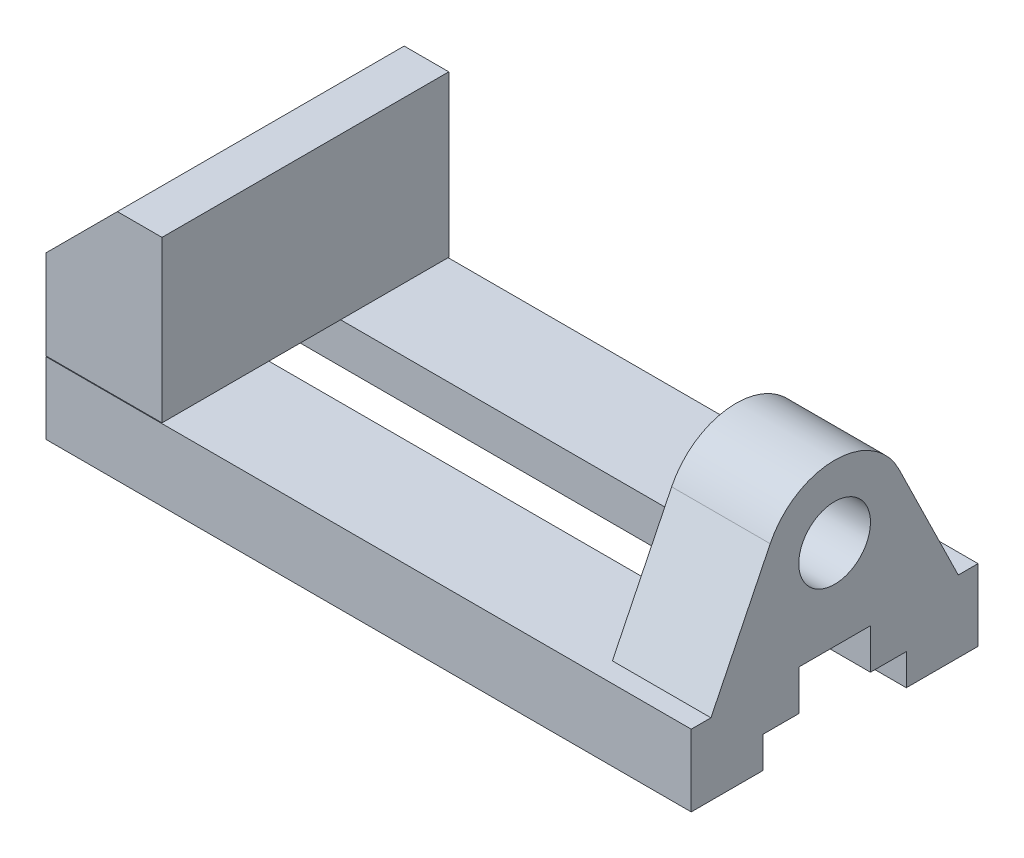
from build123d import *

# Parameters (mm, degrees)
SKETCH1_W           = 144
SKETCH1_H           = 16
BOSS_EXTRUDE1_DEPTH = 32
BOSS_EXTRUDE2_DEPTH = 64
SKETCH3_R           = 8
BOSS_EXTRUDE3_DEPTH = 22
CUT_EXTRUDE1_DEPTH  = 154.935051239


with BuildPart() as part:
    # Sketch1 → Boss-Extrude1 (new, symmetric)
    with BuildSketch(Plane.XY):
        Rectangle(SKETCH1_W, SKETCH1_H)
    extrude(amount=BOSS_EXTRUDE1_DEPTH, both=True)

    # Sketch3 → Boss-Extrude3 (add)
    with BuildSketch(Plane(origin=(72, 0, 0), x_dir=(0, 0, -1), z_dir=(1, 0, 0))):
        with BuildLine():
            Line((-27.596884244, 8), (-32, 8))
            Line((-32, 8), (-32, -8))
            Line((-32, -8), (32, -8))
            Line((32, -8), (32, 8))
            Line((32, 8), (27.596884244, 8))
            Line((27.596884244, 8), (14.372185951, 35.031377602))
            ThreePointArc((14.372185951, 35.031377602), (0, 44), (-14.372185951, 35.031377602))
            Line((-14.372185951, 35.031377602), (-27.596884244, 8))
        make_face()
        with Locations(Location((0, 28, 0), (0, 0, 90))):
            Circle(SKETCH3_R, mode=Mode.SUBTRACT)
    extrude(amount=-BOSS_EXTRUDE3_DEPTH)

    # Sketch4 → Cut-Extrude1 (cut, through all)
    with BuildSketch(Plane(origin=(72, 0, 0), x_dir=(0, 0, -1), z_dir=(1, 0, 0))):
        Polygon((8, 8), (-8, 8), (-8, -1), (-16, -1), (-16, -8), (16, -8), (16, -1), (8, -1), align=None)
    extrude(amount=-CUT_EXTRUDE1_DEPTH, mode=Mode.SUBTRACT)


with BuildPart() as body_2:
    # Sketch2 → Boss-Extrude2 (new body)
    with BuildSketch(Plane.XY.offset(32)):
        Polygon((-72, 8.15004748), (-46.108367624, 8.15004748), (-46.108367624, 44), (-56.066687769, 44), (-72, 28.066687769), align=None)
    extrude(amount=-BOSS_EXTRUDE2_DEPTH)


solid = Compound([part.part, body_2.part])
